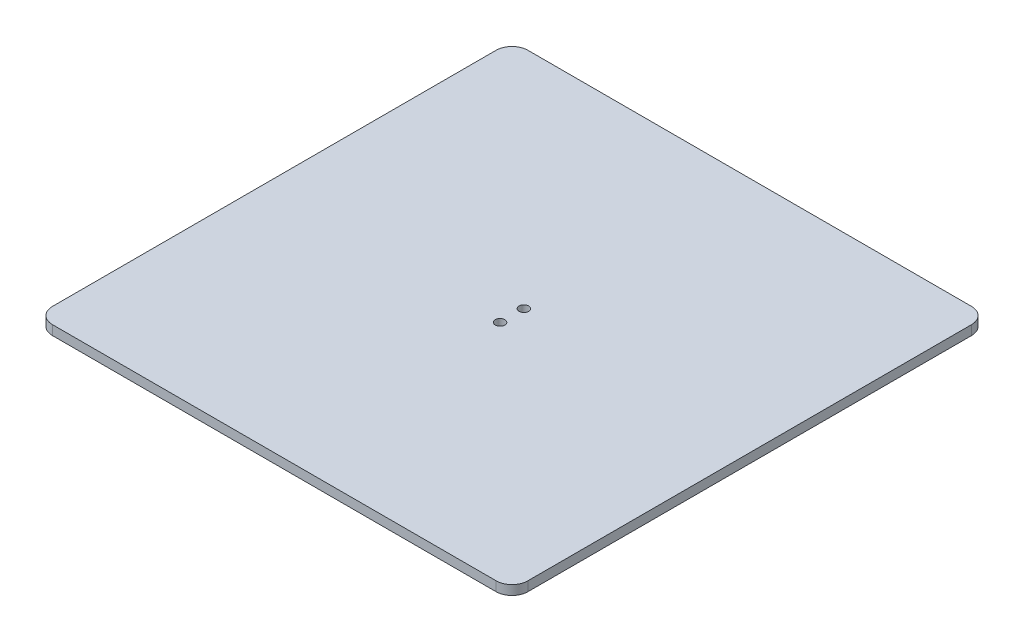
from build123d import *

# Parameters (mm, degrees)
WEIGHINGPLATEFORM_W = 300
WEIGHINGPLATEFORM_H = 300
WEIGHINGPLATEFORM_R = 3
BOSS_EXTRUDE1_DEPTH = 6
FILLET1_R           = 10


with BuildPart() as part:
    # WeighingPlateform → Boss-Extrude1 (new body)
    with BuildSketch(Plane(origin=(0, 0, 0), x_dir=(1, 0, 0), z_dir=(0, 1, 0))):
        Rectangle(WEIGHINGPLATEFORM_W, WEIGHINGPLATEFORM_H)
        with Locations(Location((0, 7.5, 0), (0, 0, 270))):
            Circle(WEIGHINGPLATEFORM_R, mode=Mode.SUBTRACT)
        with Locations(Location((0, -7.5, 0), (0, 0, 270))):
            Circle(WEIGHINGPLATEFORM_R, mode=Mode.SUBTRACT)
    extrude(amount=BOSS_EXTRUDE1_DEPTH)

    # Fillet1
    fillet1_edges = [part.edges().sort_by_distance(p)[0] for p in [
        (-150, 3, -150),
        (150, 3, -150),
        (150, 3, 150),
        (-150, 3, 150),
    ]]
    fillet(fillet1_edges, radius=FILLET1_R)


solid = part.part
